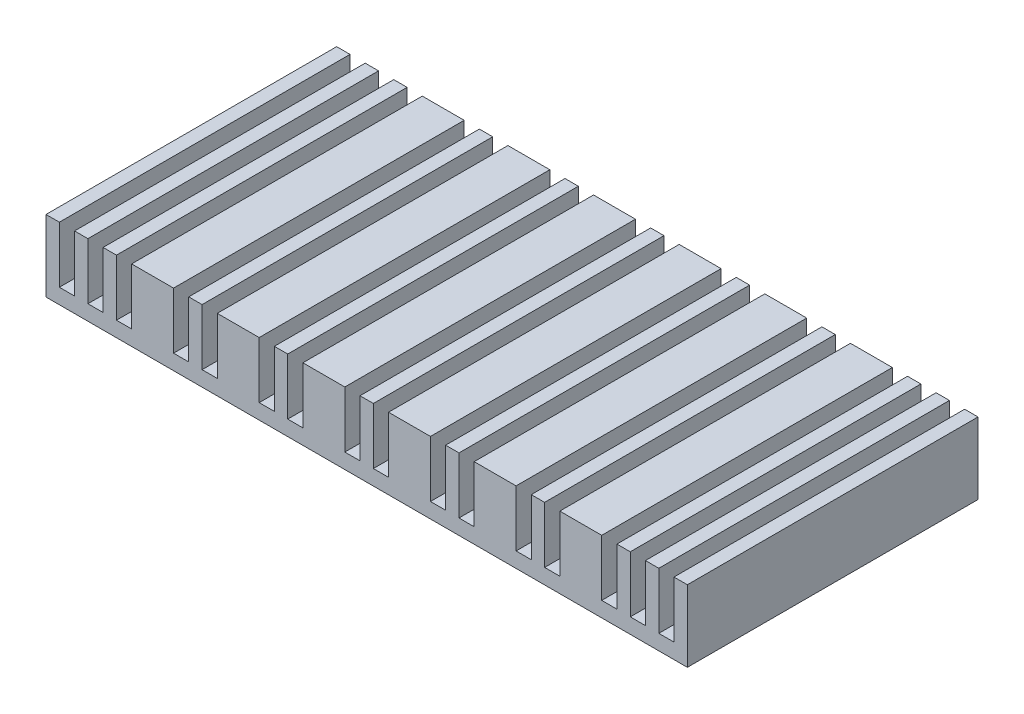
from build123d import *

# Parameters (mm, degrees)
Y_KSEKLIK_EKSTR_ZYON1_DEPTH = 40.22


with BuildPart() as part:
    # Çizim1 → Yükseklik-Ekstrüzyon1 (new body)
    with BuildSketch(Plane.XY):
        Polygon((0, 0), (0, 7.8), (1.85, 7.8), (1.85, 0), (3.95, 0), (3.95, 7.8), (5.8, 7.8), (5.8, 0), (7.9, 0), (7.9, 7.8), (9.75, 7.8), (9.75, 0), (11.85, 0), (11.85, 7.8), (17.65, 7.8), (17.65, 0), (19.75, 0), (19.75, 7.8), (21.6, 7.8), (21.6, 0), (23.7, 0), (23.7, 7.8), (29.5, 7.8), (29.5, 0), (31.6, 0), (31.6, 7.8), (33.45, 7.8), (33.45, 0), (35.55, 0), (35.55, 7.8), (41.35, 7.8), (41.35, 0), (43.45, 0), (43.45, 7.8), (45.3, 7.8), (45.3, 0), (47.4, 0), (47.4, 7.8), (53.2, 7.8), (53.2, 0), (55.3, 0), (55.3, 7.8), (57.15, 7.8), (57.15, 0), (59.25, 0), (59.25, 7.8), (65.05, 7.8), (65.05, 0), (67.15, 0), (67.15, 7.8), (69, 7.8), (69, 0), (71.1, 0), (71.1, 7.8), (76.9, 7.8), (76.9, 0), (79, 0), (79, 7.8), (80.85, 7.8), (80.85, 0), (82.95, 0), (82.95, 7.8), (84.8, 7.8), (84.8, 0), (86.9, 0), (86.9, 7.8), (88.75, 7.8), (88.75, 0), (88.75, -2.1), (0, -2.1), align=None)
    extrude(amount=Y_KSEKLIK_EKSTR_ZYON1_DEPTH)


solid = part.part
